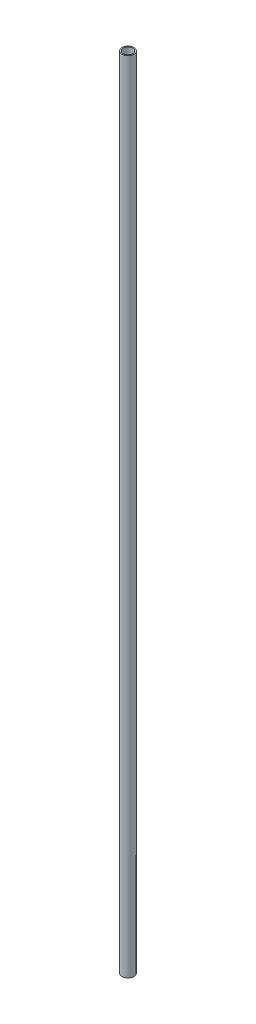
from build123d import *

# Parameters (mm, degrees)
SKETCH1_R           = 7.5
SKETCH1_R_2         = 6
BOSS_EXTRUDE1_DEPTH = 1005


with BuildPart() as part:
    # Sketch1 → Boss-Extrude1 (new body)
    with BuildSketch(Plane(origin=(0, 0, 0), x_dir=(1, 0, 0), z_dir=(0, 1, 0))):
        with Locations(Location((0, 0, 0), (0, 0, 270))):
            Circle(SKETCH1_R)
        with Locations(Location((0, 0, 0), (0, 0, 270))):
            Circle(SKETCH1_R_2, mode=Mode.SUBTRACT)
    extrude(amount=BOSS_EXTRUDE1_DEPTH)


solid = part.part
